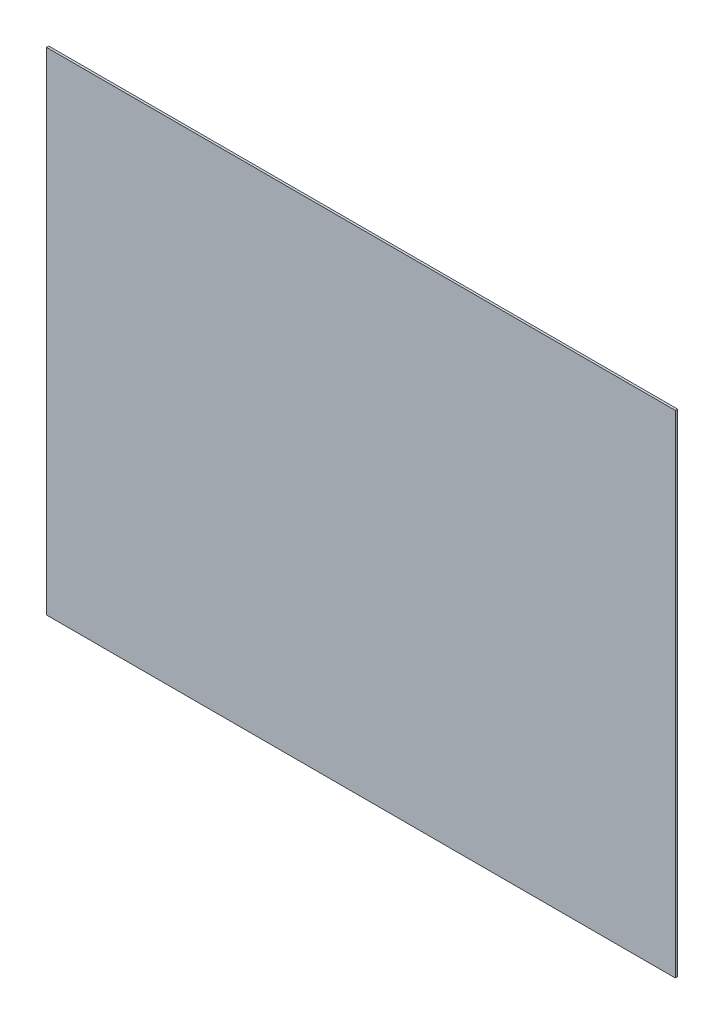
from build123d import *

# Parameters (mm, degrees)
ESBO_O1_W                = 550
ESBO_O1_H                = 430
RESSALTO_EXTRUS_O1_DEPTH = 2


with BuildPart() as part:
    # Esboço1 → Ressalto-extrusão1 (new body)
    with BuildSketch(Plane.XY):
        with Locations((275, 215)):
            Rectangle(ESBO_O1_W, ESBO_O1_H)
    extrude(amount=RESSALTO_EXTRUS_O1_DEPTH)


solid = part.part
